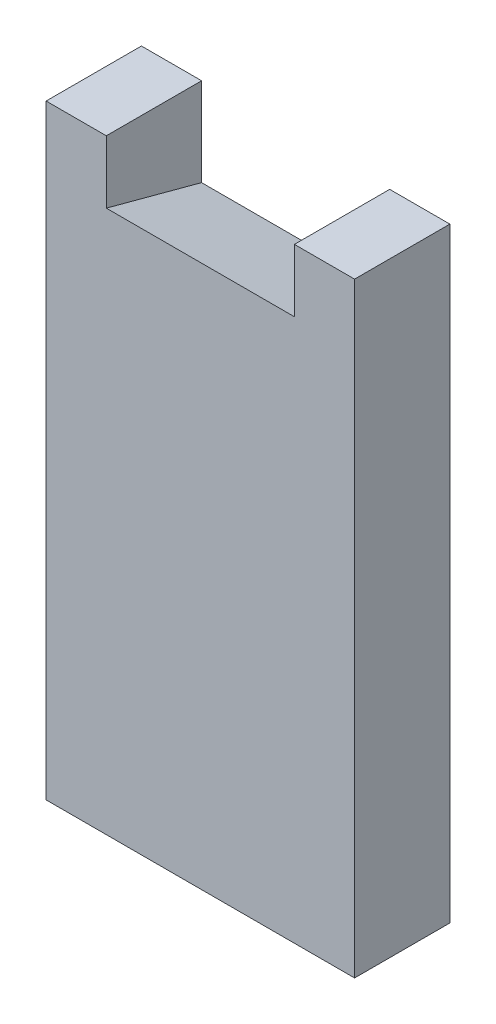
from build123d import *

# Parameters (mm, degrees)
EXTRUDE_1_DEPTH = 7.6
DRAFT_5_ANGLE   = -15


with BuildPart() as part:
    # 草图1 → 凸台-拉伸1 (new body)
    with BuildSketch(Plane.XY):
        Polygon((4.8, 0), (0, 0), (0, -48.27), (24.6, -48.27), (24.6, 0), (19.8, 0), (19.8, -5), (4.8, -5), align=None)
    extrude(amount=EXTRUDE_1_DEPTH)

    # 拔模5
    draft_5_faces = [part.faces().sort_by_distance(p)[0] for p in [
        (12.3, -5, 3.8),
    ]]
    draft(draft_5_faces, Plane.XY.offset(7.6), DRAFT_5_ANGLE)


solid = part.part
